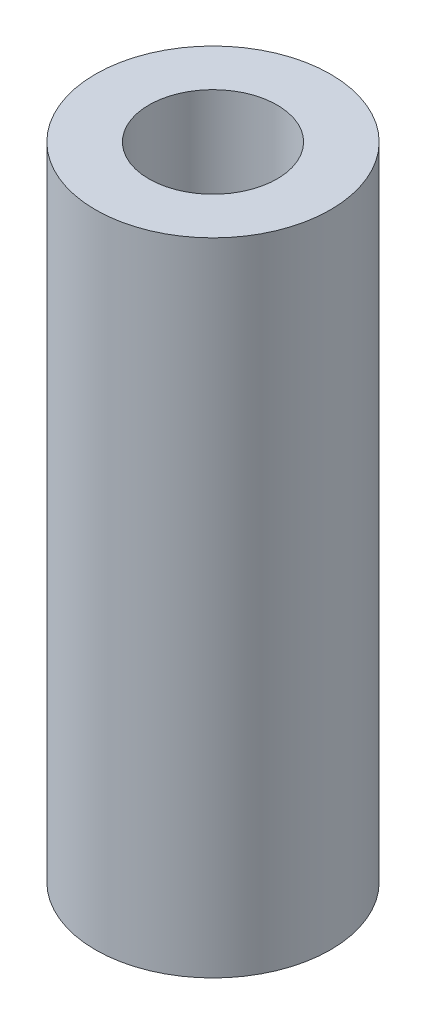
from build123d import *

# Parameters (mm, degrees)
SKETCH1_R           = 3.3
SKETCH1_R_2         = 1.8
BOSS_EXTRUDE1_DEPTH = 18


with BuildPart() as part:
    # Sketch1 → Boss-Extrude1 (new body)
    with BuildSketch(Plane(origin=(0, 0, 0), x_dir=(1, 0, 0), z_dir=(0, 1, 0))):
        with Locations(Location((0, 0, 0), (0, 0, 270))):
            Circle(SKETCH1_R)
        with Locations(Location((0, 0, 0), (0, 0, 270))):
            Circle(SKETCH1_R_2, mode=Mode.SUBTRACT)
    extrude(amount=BOSS_EXTRUDE1_DEPTH)


solid = part.part
